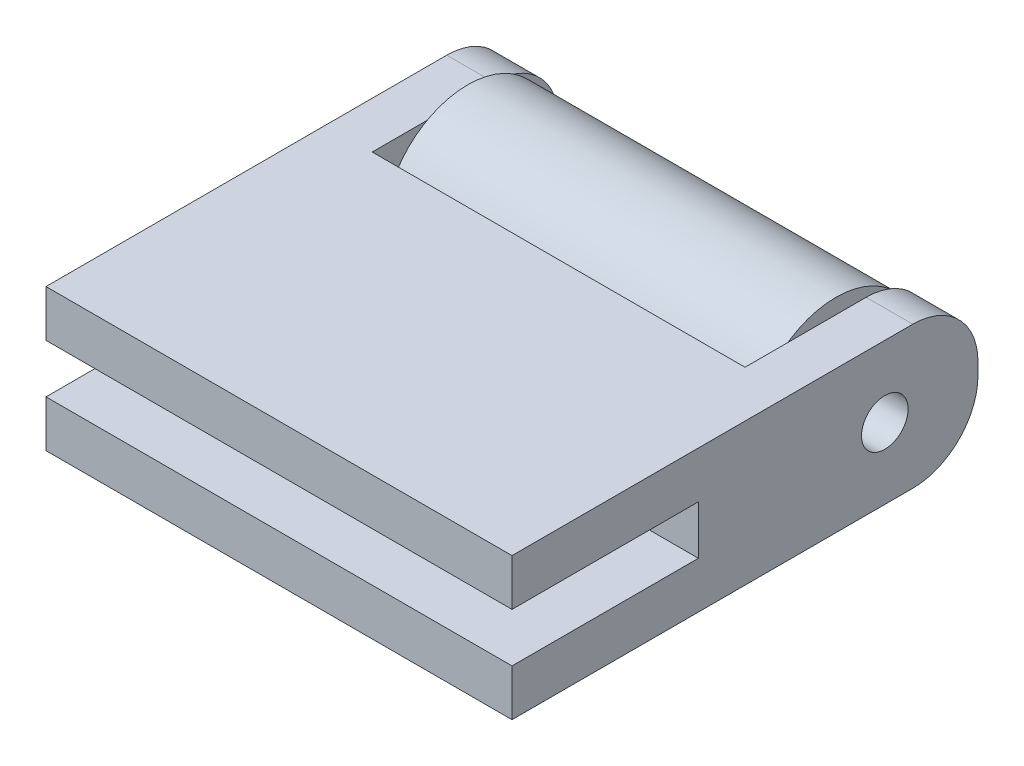
from build123d import *

# Parameters (mm, degrees)
SKETCH1_R           = 2.5
BOSS_EXTRUDE1_DEPTH = 50
SKETCH2_W           = 40
SKETCH2_H           = 20
CUT_EXTRUDE1_DEPTH  = 73.336453466
FILLET1_R           = 7
BOSS_EXTRUDE2_START = 0.25
SKETCH3_R           = 9
BOSS_EXTRUDE2_DEPTH = 39.5
SKETCH4_R           = 2.375
CUT_EXTRUDE2_DEPTH  = 70.129972696


with BuildPart() as part:
    # Sketch1 → Boss-Extrude1 (new body)
    with BuildSketch(Plane(origin=(0, 0, 0), x_dir=(0, 0, -1), z_dir=(1, 0, 0))):
        Polygon((0, 5), (0, 0), (50, 0), (50, 15.25), (0, 15.25), (0, 10.25), (20, 10.25), (20, 5), align=None)
        with Locations((40, 7.625)):
            Circle(SKETCH1_R, mode=Mode.SUBTRACT)
    extrude(amount=BOSS_EXTRUDE1_DEPTH)

    # Sketch2 → Cut-Extrude1 (cut, through all)
    with BuildSketch(Plane(origin=(0, 15.25, 0), x_dir=(1, 0, 0), z_dir=(0, 1, 0))):
        with Locations((25, 40)):
            Rectangle(SKETCH2_W, SKETCH2_H)
    extrude(amount=-CUT_EXTRUDE1_DEPTH, mode=Mode.SUBTRACT)

    # Fillet1
    fillet1_edges = [part.edges().sort_by_distance(p)[0] for p in [
        (47.5, 15.25, -50),
        (47.5, 0, -50),
        (2.5, 15.25, -50),
        (2.5, 0, -50),
    ]]
    fillet(fillet1_edges, radius=FILLET1_R)


with BuildPart() as body_2:
    # Sketch3 → Boss-Extrude2 (new body)
    with BuildSketch(Plane(origin=(5, 0, 0), x_dir=(0, 0, -1), z_dir=(1, 0, 0)).offset(BOSS_EXTRUDE2_START)):
        with Locations((40, 7.625)):
            Circle(SKETCH3_R)
    extrude(amount=BOSS_EXTRUDE2_DEPTH)

    # Sketch4 → Cut-Extrude2 (cut, through all)
    with BuildSketch(Plane.ZY.offset(-5.25)):
        with Locations((-40, 7.625)):
            Circle(SKETCH4_R)
    extrude(amount=-CUT_EXTRUDE2_DEPTH, mode=Mode.SUBTRACT)


solid = Compound([part.part, body_2.part])
